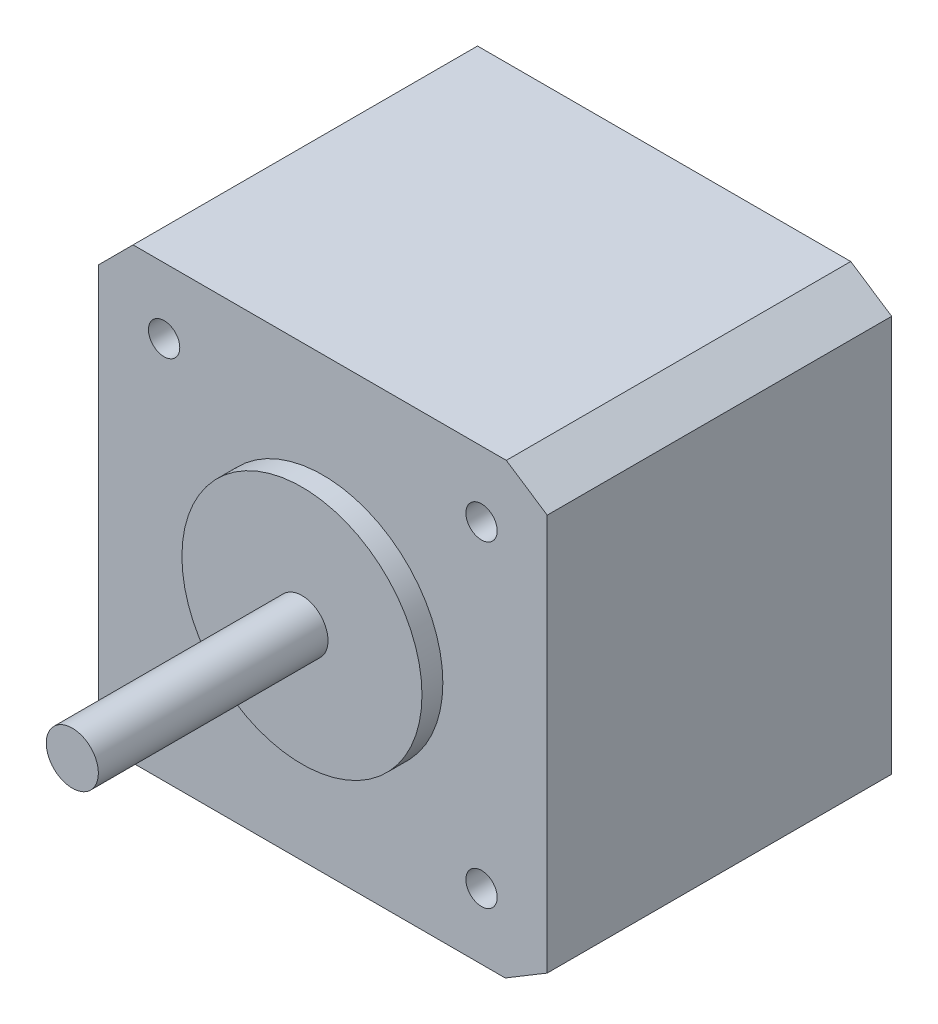
from build123d import *

# Parameters (mm, degrees)
SKETCH1_R           = 1.5
BOSS_EXTRUDE1_DEPTH = 33
SKETCH1_3_R         = 11.5
BOSS_EXTRUDE2_DEPTH = 35
SKETCH1_4_R         = 2.495506105
BOSS_EXTRUDE3_DEPTH = 57
SKETCH1_5_W         = 5.430918786
SKETCH1_5_H         = 16.000755457
BOSS_EXTRUDE4_DEPTH = 7


with BuildPart() as part:
    # Sketch1 → Boss-Extrude1 (new body)
    with BuildSketch(Plane.XY):
        Polygon((-15.184651762, 21.5), (-18.505405032, 18.179246731), (-18.505405032, -18.179246731), (-15.184651762, -21.5), (20.470167461, -21.5), (24.494594968, -19.079506704), (24.494594968, 18.915642106), (20.57338357, 21.5), align=None)
        with Locations((-12.211230799, -15.205825767)):
            Circle(SKETCH1_R, mode=Mode.SUBTRACT)
        with Locations((18.200420735, -15.205825767)):
            Circle(SKETCH1_R, mode=Mode.SUBTRACT)
        with Locations((-12.211230799, 15.205825767)):
            Circle(SKETCH1_R, mode=Mode.SUBTRACT)
        with Locations((18.200420735, 15.205825767)):
            Circle(SKETCH1_R, mode=Mode.SUBTRACT)
    extrude(amount=BOSS_EXTRUDE1_DEPTH)

    # Sketch1<3> → Boss-Extrude2 (add)
    with BuildSketch(Plane.XY):
        with Locations((2.994594968, 0)):
            Circle(SKETCH1_3_R)
    extrude(amount=BOSS_EXTRUDE2_DEPTH)

    # Sketch1<4> → Boss-Extrude3 (add)
    with BuildSketch(Plane.XY):
        with Locations((2.994594968, 0)):
            Circle(SKETCH1_4_R)
    extrude(amount=BOSS_EXTRUDE3_DEPTH)

    # Sketch1<5> → Boss-Extrude4 (add)
    with BuildSketch(Plane.XY):
        with Locations((-21.220864425, 0.037249424)):
            Rectangle(SKETCH1_5_W, SKETCH1_5_H)
    extrude(amount=BOSS_EXTRUDE4_DEPTH)


solid = part.part
